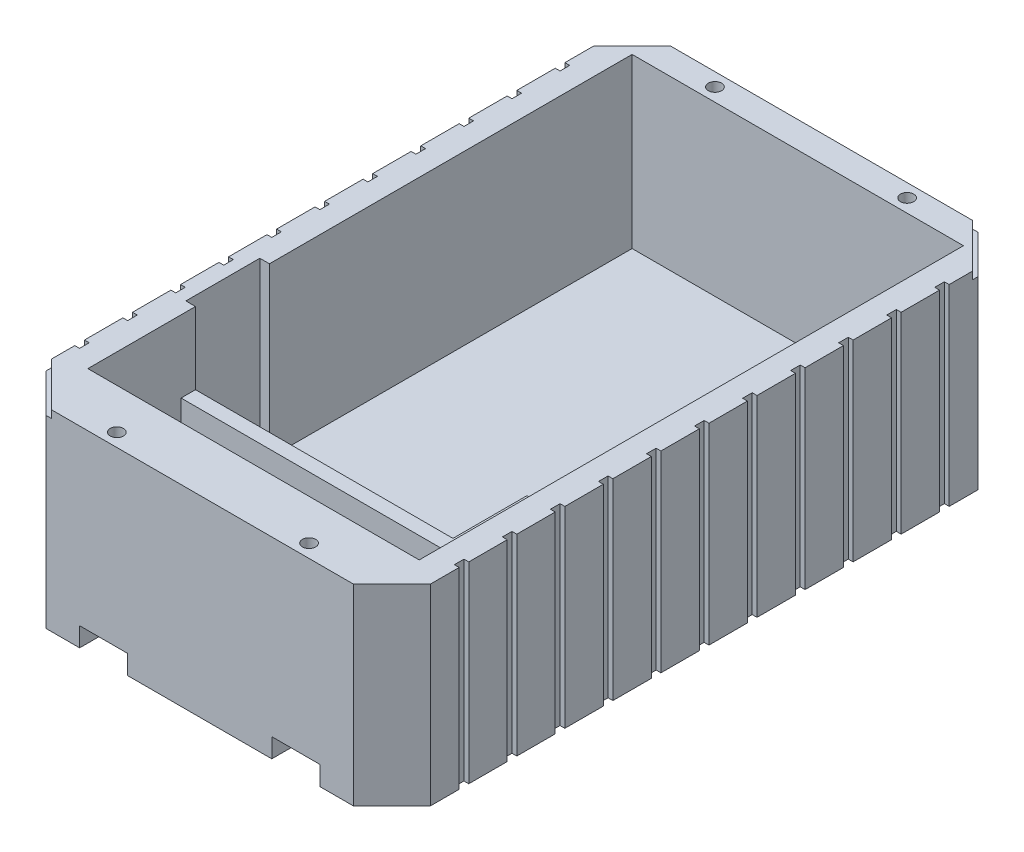
from build123d import *

# Parameters (mm, degrees)
SKETCH1_W           = 101.6
SKETCH1_H           = 165.1
BOSS_EXTRUDE1_DEPTH = 50.8
SKETCH2_W           = 2.54
SKETCH2_H           = 2.54
CUT_EXTRUDE1_DEPTH  = 110.433918417
CHAMFER1_SIZE       = 10.16
SKETCH3_W           = 87.6
SKETCH3_H           = 143.876
CUT_EXTRUDE2_DEPTH  = 44.45
CUT_EXTRUDE3_DEPTH  = 2
SKETCH5_R           = 1.750000056
CUT_EXTRUDE4_DEPTH  = 110.433918417
SKETCH6_W           = 12.7
SKETCH6_H           = 6.999986
SKETCH6_H_2         = 6.999987499
CUT_EXTRUDE5_DEPTH  = 5.08
SKETCH7_W           = 15.494
SKETCH7_H           = 11.43
CUT_EXTRUDE6_DEPTH  = 110.433918417
SKETCH9_R           = 1.75
CUT_EXTRUDE7_DEPTH  = 5.08
SKETCH10_W          = 68.072
SKETCH10_H          = 19.558
BOSS_EXTRUDE2_DEPTH = 2.54
BOSS_EXTRUDE3_DEPTH = 25.4
SKETCH12_W          = 19.558
SKETCH12_H          = 41.91
CUT_EXTRUDE8_DEPTH  = 2.54


with BuildPart() as part:
    # Sketch1 → Boss-Extrude1 (new body)
    with BuildSketch(Plane(origin=(0, 0, 0), x_dir=(1, 0, 0), z_dir=(0, 1, 0))):
        Rectangle(SKETCH1_W, SKETCH1_H)
    extrude(amount=BOSS_EXTRUDE1_DEPTH)

    # Sketch2 → Cut-Extrude1 (cut, through all)
    with BuildSketch(Plane(origin=(0, 50.8, 0), x_dir=(1, 0, 0), z_dir=(0, 1, 0))):
        with Locations((-50.8, -63.5)):
            Rectangle(SKETCH2_W, SKETCH2_H)
        with Locations((50.8, -63.5)):
            Rectangle(SKETCH2_W, SKETCH2_H)
        with Locations((-50.8, -50.8)):
            Rectangle(SKETCH2_W, SKETCH2_H)
        with Locations((50.8, -50.8)):
            Rectangle(SKETCH2_W, SKETCH2_H)
        with Locations((-50.8, -38.1)):
            Rectangle(SKETCH2_W, SKETCH2_H)
        with Locations((50.8, -38.1)):
            Rectangle(SKETCH2_W, SKETCH2_H)
        with Locations((-50.8, -25.4)):
            Rectangle(SKETCH2_W, SKETCH2_H)
        with Locations((50.8, -25.4)):
            Rectangle(SKETCH2_W, SKETCH2_H)
        with Locations((-50.8, -12.7)):
            Rectangle(SKETCH2_W, SKETCH2_H)
        with Locations((50.8, -12.7)):
            Rectangle(SKETCH2_W, SKETCH2_H)
        with Locations((-50.8, 0)):
            Rectangle(SKETCH2_W, SKETCH2_H)
        with Locations((50.8, 0)):
            Rectangle(SKETCH2_W, SKETCH2_H)
        with Locations((-50.8, 12.7)):
            Rectangle(SKETCH2_W, SKETCH2_H)
        with Locations((50.8, 12.7)):
            Rectangle(SKETCH2_W, SKETCH2_H)
        with Locations((-50.8, 25.4)):
            Rectangle(SKETCH2_W, SKETCH2_H)
        with Locations((50.8, 25.4)):
            Rectangle(SKETCH2_W, SKETCH2_H)
        with Locations((-50.8, 38.1)):
            Rectangle(SKETCH2_W, SKETCH2_H)
        with Locations((50.8, 38.1)):
            Rectangle(SKETCH2_W, SKETCH2_H)
        with Locations((-50.8, 50.8)):
            Rectangle(SKETCH2_W, SKETCH2_H)
        with Locations((50.8, 50.8)):
            Rectangle(SKETCH2_W, SKETCH2_H)
        with Locations((-50.8, 63.5)):
            Rectangle(SKETCH2_W, SKETCH2_H)
        with Locations((50.8, 63.5)):
            Rectangle(SKETCH2_W, SKETCH2_H)
    extrude(amount=-CUT_EXTRUDE1_DEPTH, mode=Mode.SUBTRACT)

    # Chamfer1
    chamfer1_edges = [part.edges().sort_by_distance(p)[0] for p in [
        (50.8, 25.4, 82.55),
        (-50.8, 25.4, 82.55),
        (-50.8, 25.4, -82.55),
        (50.8, 25.4, -82.55),
    ]]
    chamfer(chamfer1_edges, length=CHAMFER1_SIZE)

    # Sketch3 → Cut-Extrude2 (cut)
    with BuildSketch(Plane(origin=(0, 50.8, 0), x_dir=(1, 0, 0), z_dir=(0, 1, 0))):
        with Locations((0, 3.612)):
            Rectangle(SKETCH3_W, SKETCH3_H)
    extrude(amount=-CUT_EXTRUDE2_DEPTH, mode=Mode.SUBTRACT)

    # Sketch4 → Cut-Extrude3 (cut)
    with BuildSketch(Plane(origin=(0, 50.8, 0), x_dir=(1, 0, 0), z_dir=(0, 1, 0))):
        Polygon((45.012893219, 76.762893219), (50.8, 70.975786438), (50.8, 72.39), (40.64, 82.55), (39.225786438, 82.55), align=None)
        Polygon((-45.012893219, -76.762893219), (-50.8, -70.975786438), (-50.8, -72.39), (-40.64, -82.55), (-39.225786438, -82.55), align=None)
    extrude(amount=-CUT_EXTRUDE3_DEPTH, mode=Mode.SUBTRACT)

    # Sketch5 → Cut-Extrude4 (cut, through all)
    with BuildSketch(Plane(origin=(0, 50.8, 0), x_dir=(1, 0, 0), z_dir=(0, 1, 0))):
        with Locations(Location((-25.4, -79.05, 0), (0, 0, 270))):
            Circle(SKETCH5_R)
        with Locations(Location((25.4, -79.05, 0), (0, 0, 270))):
            Circle(SKETCH5_R)
        with Locations(Location((25.4, 79.05, 0), (0, 0, 270))):
            Circle(SKETCH5_R)
        with Locations(Location((-25.4, 79.05, 0), (0, 0, 270))):
            Circle(SKETCH5_R)
    extrude(amount=-CUT_EXTRUDE4_DEPTH, mode=Mode.SUBTRACT)

    # Sketch6 → Cut-Extrude5 (cut)
    with BuildSketch(Plane.XZ):
        with Locations((-25.4, 79.050007)):
            Rectangle(SKETCH6_W, SKETCH6_H)
        with Locations((25.4, 79.050007)):
            Rectangle(SKETCH6_W, SKETCH6_H)
        with Locations((-25.4, -79.050007)):
            Rectangle(SKETCH6_W, SKETCH6_H)
        with Locations((25.4, -79.050006251)):
            Rectangle(SKETCH6_W, SKETCH6_H_2)
    extrude(amount=-CUT_EXTRUDE5_DEPTH, mode=Mode.SUBTRACT)

    # Sketch7 → Cut-Extrude6 (cut, through all)
    with BuildSketch(Plane.XZ):
        with Locations((0, 59.055)):
            Rectangle(SKETCH7_W, SKETCH7_H)
    extrude(amount=-CUT_EXTRUDE6_DEPTH, mode=Mode.SUBTRACT)

    # Sketch9 → Cut-Extrude7 (cut)
    with BuildSketch(Plane(origin=(0, 0, 68.326), x_dir=(-1, 0, 0), z_dir=(0, 0, -1))):
        with Locations((-9.933999944, 31.651)):
            Circle(SKETCH9_R)
        with Locations((10.187999944, 31.650999944)):
            Circle(SKETCH9_R)
        with Locations((10.187999944, 14.196)):
            Circle(SKETCH9_R)
        with Locations((-9.933999944, 14.069000056)):
            Circle(SKETCH9_R)
    extrude(amount=-CUT_EXTRUDE7_DEPTH, mode=Mode.SUBTRACT)

    # Sketch10 → Boss-Extrude2 (add)
    with BuildSketch(Plane(origin=(0, 6.35, 0), x_dir=(1, 0, 0), z_dir=(0, 1, 0))):
        with Locations((-9.764, -30.099)):
            Rectangle(SKETCH10_W, SKETCH10_H)
    extrude(amount=BOSS_EXTRUDE2_DEPTH)

    # Sketch11 → Boss-Extrude3 (add)
    with BuildSketch(Plane(origin=(0, 6.35, 0), x_dir=(1, 0, 0), z_dir=(0, 1, 0))):
        Polygon((-43.8, -43.688), (28.082, -43.688), (28.082, -20.32), (24.272, -20.32), (24.272, -39.878), (-43.8, -39.878), align=None)
    extrude(amount=BOSS_EXTRUDE3_DEPTH)

    # Sketch12 → Cut-Extrude8 (cut)
    with BuildSketch(Plane(origin=(-43.8, 0, 0), x_dir=(0, 0, -1), z_dir=(1, 0, 0))):
        with Locations((-30.099, 29.845)):
            Rectangle(SKETCH12_W, SKETCH12_H)
    extrude(amount=-CUT_EXTRUDE8_DEPTH, mode=Mode.SUBTRACT)


solid = part.part
